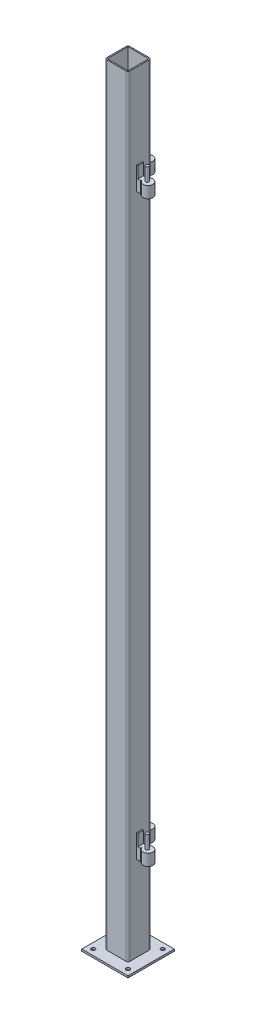
from build123d import *

# Parameters (mm, degrees)
SKETCH_1_W                         = 120
SKETCH_1_H                         = 120
EXTRUDE_1_DEPTH                    = 5
SKETCH_2_W                         = 60
SKETCH_2_H                         = 60
SKETCH_2_W_2                       = 54
SKETCH_2_H_2                       = 54
EXTRUDE_2_DEPTH                    = 2000
FILLET_1_R                         = 5
SKETCH_3_R                         = 5
CUT_EXTRUDE_1_DEPTH                = 2000
EXTRUDE_5_DEPTH                    = 7.5
PATTERN_LINEAR_1_COUNT             = 2
PATTERN_LINEAR_1_PITCH             = 1500
SKETCH_7_R                         = 12.5
EXTRUDE_6_DEPTH                    = 30
SKETCH_8_R                         = 4
EXTRUDE_7_DEPTH                    = 35
PATTERN_LINEAR_2_COUNT             = 2
PATTERN_LINEAR_2_PITCH             = 1500
PATTERN_CIRCULAR_2_COUNT           = 2
PATTERN_CIRCULAR_2_ANGLE           = 90
PATTERN_CIRCULAR_2_COPY_1_DEPTH    = 7.5
PATTERN_CIRCULAR_2_COPY_2_SKETCH_R = 12.5
PATTERN_CIRCULAR_2_COPY_2_DEPTH    = 30
PATTERN_CIRCULAR_2_COPY_3_SKETCH_R = 4
PATTERN_CIRCULAR_2_COPY_3_DEPTH    = 35


with BuildPart() as part:
    # 草图1 → 凸台-拉伸1 (new body)
    with BuildSketch(Plane(origin=(0, 0, 0), x_dir=(1, 0, 0), z_dir=(0, 1, 0))):
        Rectangle(SKETCH_1_W, SKETCH_1_H)
    extrude(amount=EXTRUDE_1_DEPTH)

    # 草图2 → 凸台-拉伸2 (add)
    with BuildSketch(Plane(origin=(0, 5, 0), x_dir=(1, 0, 0), z_dir=(0, 1, 0))):
        Rectangle(SKETCH_2_W, SKETCH_2_H)
        Rectangle(SKETCH_2_W_2, SKETCH_2_H_2, mode=Mode.SUBTRACT)
    extrude(amount=EXTRUDE_2_DEPTH)

    # 圆角1
    fillet_1_edges = [part.edges().sort_by_distance(p)[0] for p in [
        (-30, 1005, 30),
        (30, 1005, 30),
        (-30, 1005, -30),
        (30, 1005, -30),
    ]]
    fillet(fillet_1_edges, radius=FILLET_1_R)

    # 草图3 → 切除-拉伸1 (cut)
    with BuildSketch(Plane(origin=(0, 5, 0), x_dir=(1, 0, 0), z_dir=(0, 1, 0))):
        with Locations((-45, 45)):
            Circle(SKETCH_3_R)
        with Locations((45, 45)):
            Circle(SKETCH_3_R)
        with Locations((-45, -45)):
            Circle(SKETCH_3_R)
        with Locations((45, -45)):
            Circle(SKETCH_3_R)
    extrude(amount=-CUT_EXTRUDE_1_DEPTH, mode=Mode.SUBTRACT)

    # 草图6 → 凸台-拉伸5 (add, symmetric)
    with BuildSketch(Plane(origin=(0, 0, 0), x_dir=(0, 0, -1), z_dir=(1, 0, 0))):
        Polygon((30, 1785), (30, 1725), (40, 1725), (40, 1755), (33, 1755), (33, 1785), align=None)
    extrude_5 = extrude(amount=EXTRUDE_5_DEPTH, both=True)

    # 阵列(线性)1: 凸台-拉伸5 ×2
    with Locations(*[(0, -i * PATTERN_LINEAR_1_PITCH, 0) for i in range(1, PATTERN_LINEAR_1_COUNT)]):
        add(extrude_5)

    # 草图7 → 凸台-拉伸6 (add)
    with BuildSketch(Plane(origin=(0, 1755, 0), x_dir=(1, 0, 0), z_dir=(0, 1, 0))):
        with Locations((0, 52)):
            Circle(SKETCH_7_R)
    extrude_6 = extrude(amount=-EXTRUDE_6_DEPTH)

    # 草图8 → 凸台-拉伸7 (add)
    with BuildSketch(Plane(origin=(0, 1755, 0), x_dir=(1, 0, 0), z_dir=(0, 1, 0))):
        with Locations((0, 50)):
            Circle(SKETCH_8_R)
    extrude_7 = extrude(amount=EXTRUDE_7_DEPTH)

    # 阵列(线性)2: 凸台-拉伸6, 凸台-拉伸7 ×2
    with Locations(*[(0, -i * PATTERN_LINEAR_2_PITCH, 0) for i in range(1, PATTERN_LINEAR_2_COUNT)]):
        add(extrude_6)
        add(extrude_7)

    # 阵列(圆周)2: 凸台-拉伸5, 凸台-拉伸6, 凸台-拉伸7 ×2 about axis
    pattern_circular_2_axis = Axis((0, 2105, 0), (0, -1, 0))
    add([extrude_5.rotate(pattern_circular_2_axis, i * PATTERN_CIRCULAR_2_ANGLE / (PATTERN_CIRCULAR_2_COUNT - 1)) for i in range(1, PATTERN_CIRCULAR_2_COUNT)])
    add([extrude_6.rotate(pattern_circular_2_axis, i * PATTERN_CIRCULAR_2_ANGLE / (PATTERN_CIRCULAR_2_COUNT - 1)) for i in range(1, PATTERN_CIRCULAR_2_COUNT)])
    add([extrude_7.rotate(pattern_circular_2_axis, i * PATTERN_CIRCULAR_2_ANGLE / (PATTERN_CIRCULAR_2_COUNT - 1)) for i in range(1, PATTERN_CIRCULAR_2_COUNT)])

    # 阵列(圆周)2 copy 1 sketch → 阵列(圆周)2 copy 1 (add, symmetric)
    with BuildSketch(Plane(origin=(0, -1500, 0), x_dir=(1, 0, 0), z_dir=(0, 0, 1))):
        Polygon((30, 1785), (30, 1725), (40, 1725), (40, 1755), (33, 1755), (33, 1785), align=None)
    extrude(amount=PATTERN_CIRCULAR_2_COPY_1_DEPTH, both=True)

    # 阵列(圆周)2 copy 2 sketch → 阵列(圆周)2 copy 2 (add)
    with BuildSketch(Plane.ZX.offset(255)):
        with Locations((0, 52)):
            Circle(PATTERN_CIRCULAR_2_COPY_2_SKETCH_R)
    extrude(amount=-PATTERN_CIRCULAR_2_COPY_2_DEPTH)

    # 阵列(圆周)2 copy 3 sketch → 阵列(圆周)2 copy 3 (add)
    with BuildSketch(Plane.ZX.offset(255)):
        with Locations((0, 50)):
            Circle(PATTERN_CIRCULAR_2_COPY_3_SKETCH_R)
    extrude(amount=PATTERN_CIRCULAR_2_COPY_3_DEPTH)


solid = part.part
